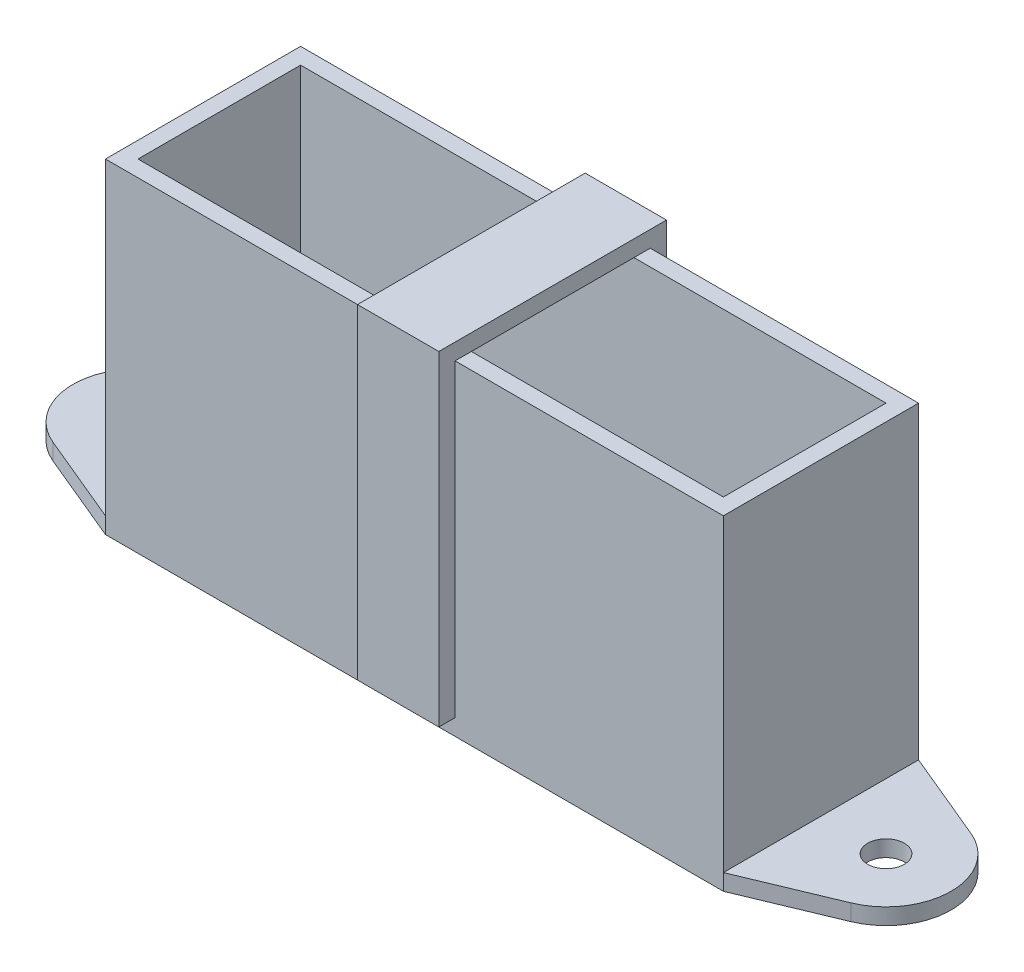
from build123d import *

# Parameters (mm, degrees)
SKETCH15_W                    = 76
SKETCH15_H                    = 24
SKETCH15_W_2                  = 72
SKETCH15_H_2                  = 20
BOSS_EXTRUDE8_DEPTH           = 38
SKETCH16_W                    = 10
SKETCH16_H                    = 24
BOSS_EXTRUDE9_DEPTH           = 2
SKETCH17_W                    = 10
SKETCH17_H                    = 40
BOSS_EXTRUDE10_DEPTH          = 2
BOSS_EXTRUDE11_DEPTH          = 2
SKETCH20_W                    = 2.25
SKETCH20_H                    = 2
M4_CLEARANCE_HOLE1_AT_2_COUNT = 2
M4_CLEARANCE_HOLE1_AT_2_PITCH = 92


with BuildPart() as part:
    # Sketch15 → Boss-Extrude8 (new body)
    with BuildSketch(Plane(origin=(0, 0, 0), x_dir=(1, 0, 0), z_dir=(0, 1, 0))):
        Rectangle(SKETCH15_W, SKETCH15_H)
        Rectangle(SKETCH15_W_2, SKETCH15_H_2, mode=Mode.SUBTRACT)
    extrude(amount=BOSS_EXTRUDE8_DEPTH)

    # Sketch18 → Boss-Extrude11 (add)
    with BuildSketch(Plane.XZ):
        with BuildLine():
            Line((-38, 12), (38, 12))
            Line((38, 12), (49.076923077, 7.384615385))
            ThreePointArc((49.076923077, 7.384615385), (54, 0), (49.076923077, -7.384615385))
            Line((49.076923077, -7.384615385), (38, -12))
            Line((38, -12), (-38, -12))
            Line((-38, -12), (-49.076923077, -7.384615385))
            ThreePointArc((-49.076923077, -7.384615385), (-54, 0), (-49.076923077, 7.384615385))
            Line((-49.076923077, 7.384615385), (-38, 12))
        make_face()
    extrude(amount=BOSS_EXTRUDE11_DEPTH)

    # Sketch20 → M4 Clearance Hole1 (revolve, cut)
    with BuildSketch(Plane(origin=(-46, 0, 0), x_dir=(0, 0, 1), z_dir=(1, 0, 0))):
        with Locations((1.125, 1)):
            Rectangle(SKETCH20_W, SKETCH20_H)
    m4_clearance_hole1 = revolve(axis=Axis((-46, 6.35, 0), (0, -1, 0)), mode=Mode.SUBTRACT)

    # M4 Clearance Hole1 at 2: M4 Clearance Hole1 ×2
    with Locations(*[(i * M4_CLEARANCE_HOLE1_AT_2_PITCH, 0, 0) for i in range(1, M4_CLEARANCE_HOLE1_AT_2_COUNT)]):
        add(m4_clearance_hole1, mode=Mode.SUBTRACT)


with BuildPart() as body_2:
    # Sketch16 → Boss-Extrude9 (new body)
    with BuildSketch(Plane(origin=(0, 38, 0), x_dir=(1, 0, 0), z_dir=(0, 1, 0))):
        Rectangle(SKETCH16_W, SKETCH16_H)
    extrude(amount=BOSS_EXTRUDE9_DEPTH)

    # Sketch17 → Boss-Extrude10 (add)
    with BuildSketch(Plane.XY.offset(12)):
        with Locations((0, 20)):
            Rectangle(SKETCH17_W, SKETCH17_H)
    boss_extrude10 = extrude(amount=BOSS_EXTRUDE10_DEPTH)

    # Mirror3: Boss-Extrude10 across plane
    add(boss_extrude10.mirror(Plane.XY))


solid = Compound([part.part, body_2.part])
